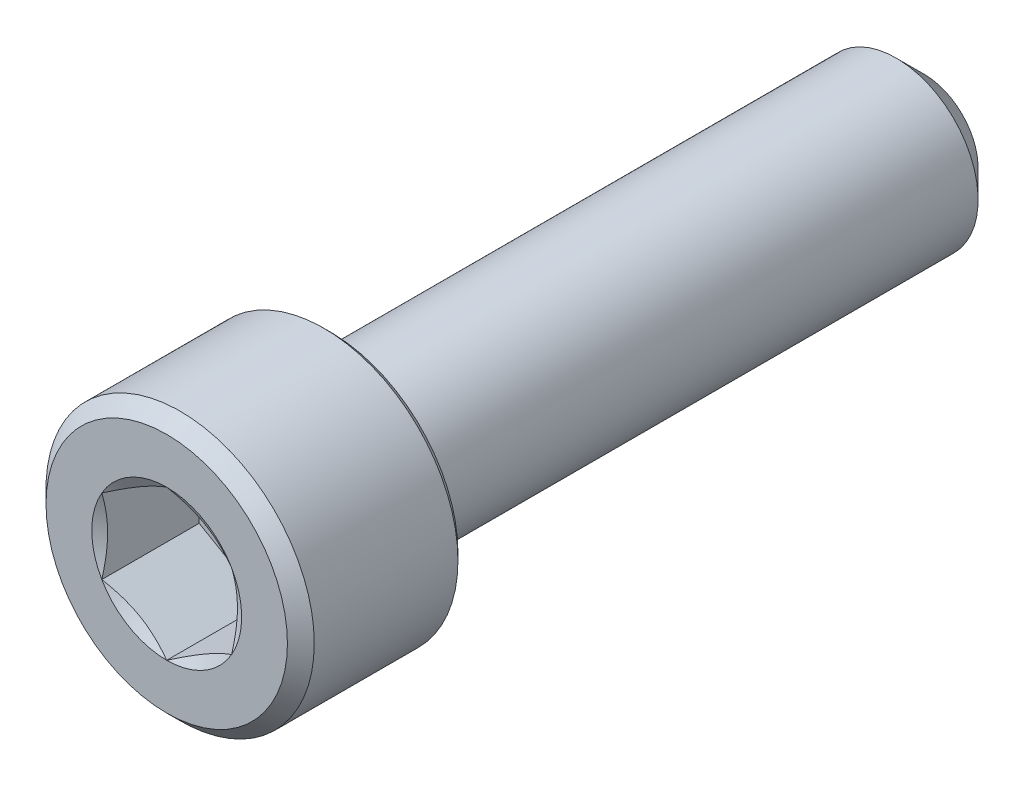
from build123d import *

# Parameters (mm, degrees)
CUT_EXTRUDE1_DEPTH = 2.08359375
CHAMFER1_SIZE      = 0.28702
CHAMFER2_SIZE      = 0.14351


with BuildPart() as part:
    # Sketch2 → Revolve1 (revolve)
    with BuildSketch(Plane(origin=(0, 0, 0), x_dir=(0, 0, -1), z_dir=(1, 0, 0)), mode=Mode.PRIVATE) as revolve1_sk:
        Polygon((8.1026, 1.1572875), (7.5072875, 1.7526), (-4.5974, 1.7526), (-4.5974, 2.8702), (-8.1026, 2.8702), (-8.1026, 0), (8.1026, 0), align=None)
    revolve(revolve1_sk.sketch.rotate(Axis((0, 0, -8.1026), (0, 0, 1)), 90), axis=Axis((0, 0, -8.1026), (0, 0, 1)))

    # Sketch4 → Cut-Extrude1 (cut)
    with BuildSketch(Plane.XY.offset(8.1026)):
        Polygon((0, 1.603951217), (-1.3890625, 0.801975608), (-1.3890625, -0.801975608), (0, -1.603951217), (1.3890625, -0.801975608), (1.3890625, 0.801975608), align=None)
    extrude(amount=-CUT_EXTRUDE1_DEPTH, mode=Mode.SUBTRACT)

    # Cut-Extrude2 cone 1 section (through the dimple's axis) → Cut-Extrude2 (revolve, cut)
    with BuildSketch(Plane(origin=(0, 0, 8.1026), x_dir=(0, -1, 0), z_dir=(1, 0, 0))):
        Polygon((0, 0), (1.603951217, 0), (0, 0.926041667), align=None)
    revolve(axis=Axis((0, 0, 8.1026), (0, 0, -1)), mode=Mode.SUBTRACT)

    # Chamfer1
    chamfer1_edges = [part.edges().sort_by_distance(p)[0] for p in [
        (2.8702, 0, 8.1026),
    ]]
    chamfer(chamfer1_edges, length=CHAMFER1_SIZE)

    # Chamfer2
    chamfer2_edges = [part.edges().sort_by_distance(p)[0] for p in [
        (2.8702, 0, 4.5974),
    ]]
    chamfer(chamfer2_edges, length=CHAMFER2_SIZE)


solid = part.part
